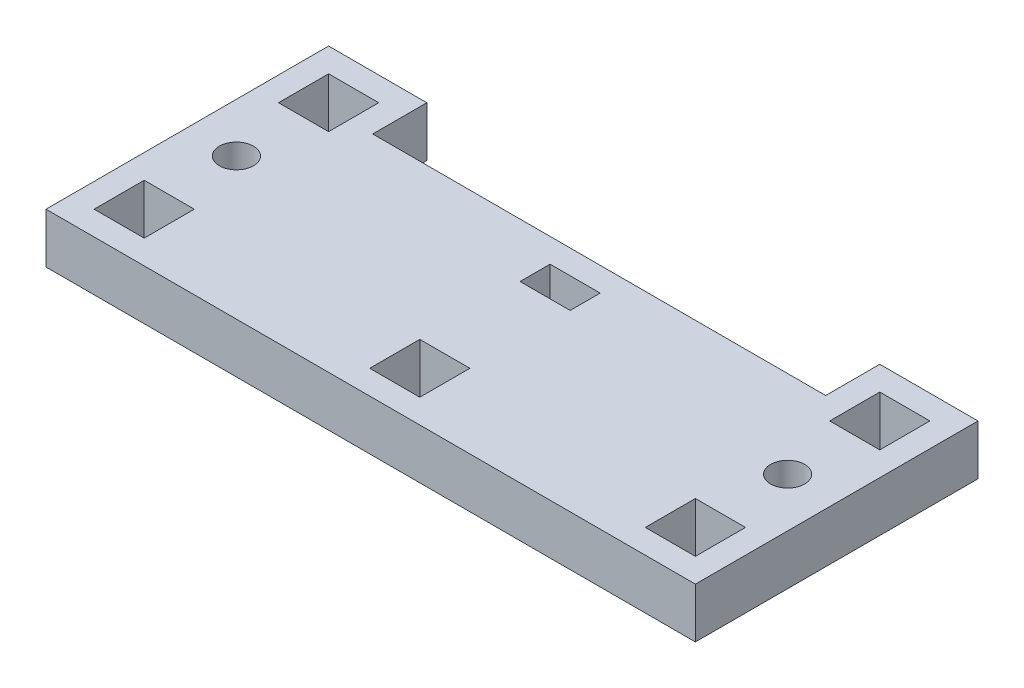
from build123d import *

# Parameters (mm, degrees)
SKETCH1_R           = 2.159
SKETCH1_W           = 6.35
SKETCH1_H           = 6.35
SKETCH1_H_2         = 3.81
BOSS_EXTRUDE1_DEPTH = 6.35


with BuildPart() as part:
    # Sketch1 → Boss-Extrude1 (new body)
    with BuildSketch(Plane(origin=(0, 0, 0), x_dir=(1, 0, 0), z_dir=(0, 1, 0))):
        Polygon((-41.148, -17.907), (41.148, -17.907), (41.148, 17.907), (28.702, 17.907), (28.702, 11.049), (-28.702, 11.049), (-28.702, 17.907), (-41.148, 17.907), align=None)
        with Locations(Location((34.925, 0, 0), (0, 0, 270))):
            Circle(SKETCH1_R, mode=Mode.SUBTRACT)
        with Locations((-34.925, 0)):
            Circle(SKETCH1_R, mode=Mode.SUBTRACT)
        with Locations((0, -11.684)):
            Rectangle(SKETCH1_W, SKETCH1_H, mode=Mode.SUBTRACT)
        with Locations((0, 6.096)):
            Rectangle(SKETCH1_W, SKETCH1_H_2, mode=Mode.SUBTRACT)
        with Locations((34.925, 11.684)):
            Rectangle(SKETCH1_W, SKETCH1_H, mode=Mode.SUBTRACT)
        with Locations((34.925, -11.684)):
            Rectangle(SKETCH1_W, SKETCH1_H, mode=Mode.SUBTRACT)
        with Locations((-34.925, 11.684)):
            Rectangle(SKETCH1_W, SKETCH1_H, mode=Mode.SUBTRACT)
        with Locations((-34.925, -11.684)):
            Rectangle(SKETCH1_W, SKETCH1_H, mode=Mode.SUBTRACT)
    extrude(amount=BOSS_EXTRUDE1_DEPTH)


solid = part.part
